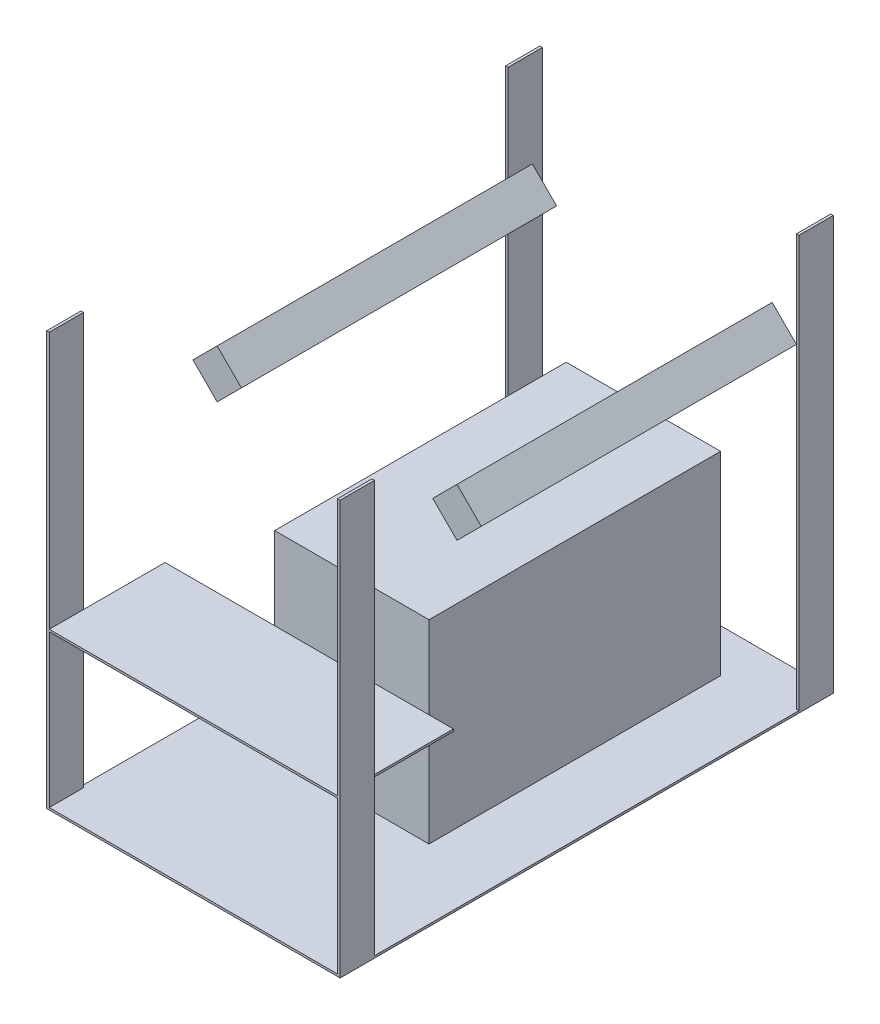
from build123d import *

# Parameters (mm, degrees)
SKETCH1_W             = 434.594
SKETCH1_H             = 730.25
BOSS_EXTRUDE1_DEPTH   = 3.175
SKETCH2_W             = 3.81
SKETCH2_H             = 50.8
BOSS_EXTRUDE2_DEPTH   = 609.6
SKETCH3_W             = 426.974
SKETCH3_H             = 171.45
BOSS_EXTRUDE3_DEPTH   = 3.175
SKETCH4_W             = 228.6
SKETCH4_H             = 431.8
BOSS_EXTRUDE4_DEPTH   = 287.655
BOSS_EXTRUDE5_DEPTH   = 466.725
BOSS_EXTRUDE5_2_DEPTH = 466.725


with BuildPart() as part:
    # Sketch1 → Boss-Extrude1 (new body)
    with BuildSketch(Plane(origin=(0, 0, 0), x_dir=(1, 0, 0), z_dir=(0, 1, 0))):
        Rectangle(SKETCH1_W, SKETCH1_H)
    extrude(amount=BOSS_EXTRUDE1_DEPTH)

    # Sketch2 → Boss-Extrude2 (add)
    with BuildSketch(Plane(origin=(0, 3.175, 0), x_dir=(1, 0, 0), z_dir=(0, 1, 0))):
        with Locations((-215.392, -339.725)):
            Rectangle(SKETCH2_W, SKETCH2_H)
        with Locations((215.392, -339.725)):
            Rectangle(SKETCH2_W, SKETCH2_H)
        with Locations((215.392, 339.725)):
            Rectangle(SKETCH2_W, SKETCH2_H)
        with Locations((-215.392, 339.725)):
            Rectangle(SKETCH2_W, SKETCH2_H)
    extrude(amount=BOSS_EXTRUDE2_DEPTH)

    # Sketch3 → Boss-Extrude3 (add)
    with BuildSketch(Plane(origin=(0, 228.6, 0), x_dir=(1, 0, 0), z_dir=(0, 1, 0))):
        with Locations((0, -279.4)):
            Rectangle(SKETCH3_W, SKETCH3_H)
    extrude(amount=BOSS_EXTRUDE3_DEPTH)

    # Sketch4 → Boss-Extrude4 (add)
    with BuildSketch(Plane(origin=(0, 3.175, 0), x_dir=(1, 0, 0), z_dir=(0, 1, 0))):
        with Locations((0.127, 85.217)):
            Rectangle(SKETCH4_W, SKETCH4_H)
    extrude(amount=BOSS_EXTRUDE4_DEPTH)


with BuildPart() as body_2:
    # Sketch5 → Boss-Extrude5 (new body)
    with BuildSketch(Plane.XY.offset(152.4)):
        Polygon((177.565975516, 506.817048969), (141.644951031, 470.896024484), (177.565975516, 434.975), (213.487, 470.896024484), align=None)
    extrude(amount=-BOSS_EXTRUDE5_DEPTH)


with BuildPart() as body_3:
    # Sketch5 → Boss-Extrude5 2 (new body)
    with BuildSketch(Plane.XY.offset(152.4)):
        Polygon((-177.565975516, 434.975), (-213.487, 470.896024484), (-177.565975516, 506.817048969), (-141.644951031, 470.896024484), align=None)
    extrude(amount=-BOSS_EXTRUDE5_2_DEPTH)


solid = Compound([part.part, body_2.part, body_3.part])
